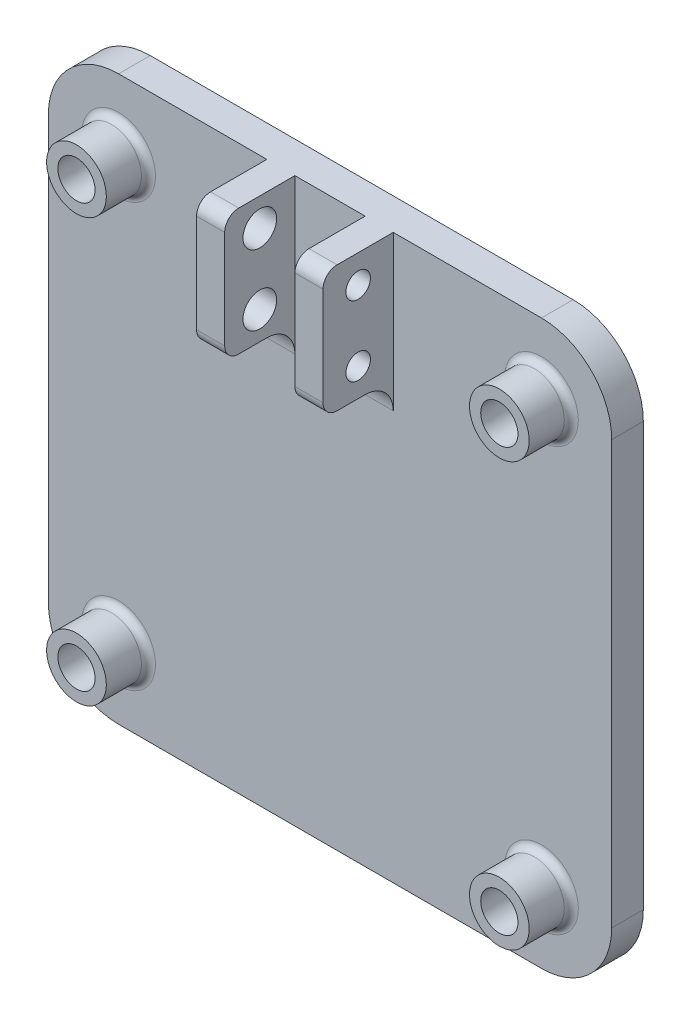
from build123d import *

# Parameters (mm, degrees)
SKETCH1_W            = 80.2
SKETCH1_H            = 80.2
BOSS_EXTRUDE1_DEPTH  = 4.5
M5_CLEARANCE_HOLE1_D = 5.3
FILLET1_R            = 10
SKETCH3_W            = 4
SKETCH3_H            = 18
BOSS_EXTRUDE2_DEPTH  = 10
CUT_EXTRUDE1_REACH   = 67.031
SKETCH5_R            = 1.75
CUT_EXTRUDE2_REACH   = 67.031
SKETCH6_R            = 2.4
FILLET2_R            = 2
FILLET3_R            = 4
BOSS_EXTRUDE3_START  = 6
SKETCH7_R            = 4.25
SKETCH7_R_2          = 2.65
BOSS_EXTRUDE3_DEPTH  = 6
FILLET5_R            = 1


with BuildPart() as part:
    # Sketch1 → Boss-Extrude1 (new body)
    with BuildSketch(Plane.XY):
        Rectangle(SKETCH1_W, SKETCH1_H)
    extrude(amount=BOSS_EXTRUDE1_DEPTH)

    # M5 Clearance Hole1 (through all)
    with Locations(Plane(origin=(30.1, 30.1, 0), x_dir=(-1, 0, 0), z_dir=(0, 0, -1))):
        with Locations((0, 0), (60.2, 0), (60.2, -60.2), (0, -60.2)):
            Hole(M5_CLEARANCE_HOLE1_D / 2)

    # Fillet1
    fillet1_edges = [part.edges().sort_by_distance(p)[0] for p in [
        (-40.1, -40.1, 2.25),
        (-40.1, 40.1, 2.25),
        (40.1, 40.1, 2.25),
        (40.1, -40.1, 2.25),
    ]]
    fillet(fillet1_edges, radius=FILLET1_R)

    # Sketch3 → Boss-Extrude2 (add)
    with BuildSketch(Plane.XY.offset(4.5)):
        with Locations((-7, 31.1)):
            Rectangle(SKETCH3_W, SKETCH3_H)
        with Locations((7, 31.1)):
            Rectangle(SKETCH3_W, SKETCH3_H)
    extrude(amount=BOSS_EXTRUDE2_DEPTH)

    # Sketch5 → Cut-Extrude1 (cut, up to next)
    with BuildSketch(Plane(origin=(9, 0, 0), x_dir=(0, 0, -1), z_dir=(1, 0, 0)), mode=Mode.PRIVATE) as cut_extrude1_sk1:
        with Locations(Location((-9.5, 36.1, 0), (0, 0, 90))):
            Circle(SKETCH5_R)
    cut_extrude1_tool1 = extrude(cut_extrude1_sk1.sketch, amount=-CUT_EXTRUDE1_REACH, mode=Mode.PRIVATE) & part.part
    # Sketch5 → Cut-Extrude1 (cut, up to next)
    with BuildSketch(Plane(origin=(9, 0, 0), x_dir=(0, 0, -1), z_dir=(1, 0, 0)), mode=Mode.PRIVATE) as cut_extrude1_sk2:
        with Locations(Location((-9.5, 26.1, 0), (0, 0, 90))):
            Circle(SKETCH5_R)
    cut_extrude1_tool2 = extrude(cut_extrude1_sk2.sketch, amount=-CUT_EXTRUDE1_REACH, mode=Mode.PRIVATE) & part.part
    add(cut_extrude1_tool1.solids().sort_by_distance((9, 36.1, 9.5))[0], mode=Mode.SUBTRACT)
    add(cut_extrude1_tool2.solids().sort_by_distance((9, 26.1, 9.5))[0], mode=Mode.SUBTRACT)

    # Sketch6 → Cut-Extrude2 (cut, up to next)
    with BuildSketch(Plane.ZY.offset(9), mode=Mode.PRIVATE) as cut_extrude2_sk1:
        with Locations((9.5, 36.1)):
            Circle(SKETCH6_R)
    cut_extrude2_tool1 = extrude(cut_extrude2_sk1.sketch, amount=-CUT_EXTRUDE2_REACH, mode=Mode.PRIVATE) & part.part
    # Sketch6 → Cut-Extrude2 (cut, up to next)
    with BuildSketch(Plane.ZY.offset(9), mode=Mode.PRIVATE) as cut_extrude2_sk2:
        with Locations((9.5, 26.1)):
            Circle(SKETCH6_R)
    cut_extrude2_tool2 = extrude(cut_extrude2_sk2.sketch, amount=-CUT_EXTRUDE2_REACH, mode=Mode.PRIVATE) & part.part
    add(cut_extrude2_tool1.solids().sort_by_distance((-9, 36.1, 9.5))[0], mode=Mode.SUBTRACT)
    add(cut_extrude2_tool2.solids().sort_by_distance((-9, 26.1, 9.5))[0], mode=Mode.SUBTRACT)

    # Fillet2
    fillet2_edges = [part.edges().sort_by_distance(p)[0] for p in [
        (-7, 22.1, 14.5),
        (-7, 40.1, 14.5),
        (7, 40.1, 14.5),
        (7, 22.1, 14.5),
    ]]
    fillet(fillet2_edges, radius=FILLET2_R)

    # Fillet3
    fillet3_edges = [part.edges().sort_by_distance(p)[0] for p in [
        (-7, 22.1, 4.5),
        (7, 22.1, 4.5),
    ]]
    fillet(fillet3_edges, radius=FILLET3_R)

    # Sketch7 → Boss-Extrude3 (add)
    # profile 1 of 4: a face of its own
    with BuildSketch(Plane.XY.offset(4.5).offset(BOSS_EXTRUDE3_START)):
        with Locations((-30.1, 30.1)):
            Circle(SKETCH7_R)
        with Locations(Location((-30.1, 30.1, 0), (0, 0, 180))):
            Circle(SKETCH7_R_2, mode=Mode.SUBTRACT)
    # profile 2 of 4: a face of its own
    with BuildSketch(Plane.XY.offset(4.5).offset(BOSS_EXTRUDE3_START)):
        with Locations((30.1, 30.1)):
            Circle(SKETCH7_R)
        with Locations(Location((30.1, 30.1, 0), (0, 0, 180))):
            Circle(SKETCH7_R_2, mode=Mode.SUBTRACT)
    # profile 3 of 4: a face of its own
    with BuildSketch(Plane.XY.offset(4.5).offset(BOSS_EXTRUDE3_START)):
        with Locations((30.1, -30.1)):
            Circle(SKETCH7_R)
        with Locations(Location((30.1, -30.1, 0), (0, 0, 180))):
            Circle(SKETCH7_R_2, mode=Mode.SUBTRACT)
    # profile 4 of 4: a face of its own
    with BuildSketch(Plane.XY.offset(4.5).offset(BOSS_EXTRUDE3_START)):
        with Locations((-30.1, -30.1)):
            Circle(SKETCH7_R)
        with Locations(Location((-30.1, -30.1, 0), (0, 0, 180))):
            Circle(SKETCH7_R_2, mode=Mode.SUBTRACT)
    extrude(amount=-BOSS_EXTRUDE3_DEPTH)

    # Fillet5
    fillet5_edges = [part.edges().sort_by_distance(p)[0] for p in [
        (-34.35, 30.1, 4.5),
        (25.85, 30.1, 4.5),
        (25.85, -30.1, 4.5),
        (-34.35, -30.1, 4.5),
    ]]
    fillet(fillet5_edges, radius=FILLET5_R)


solid = part.part
